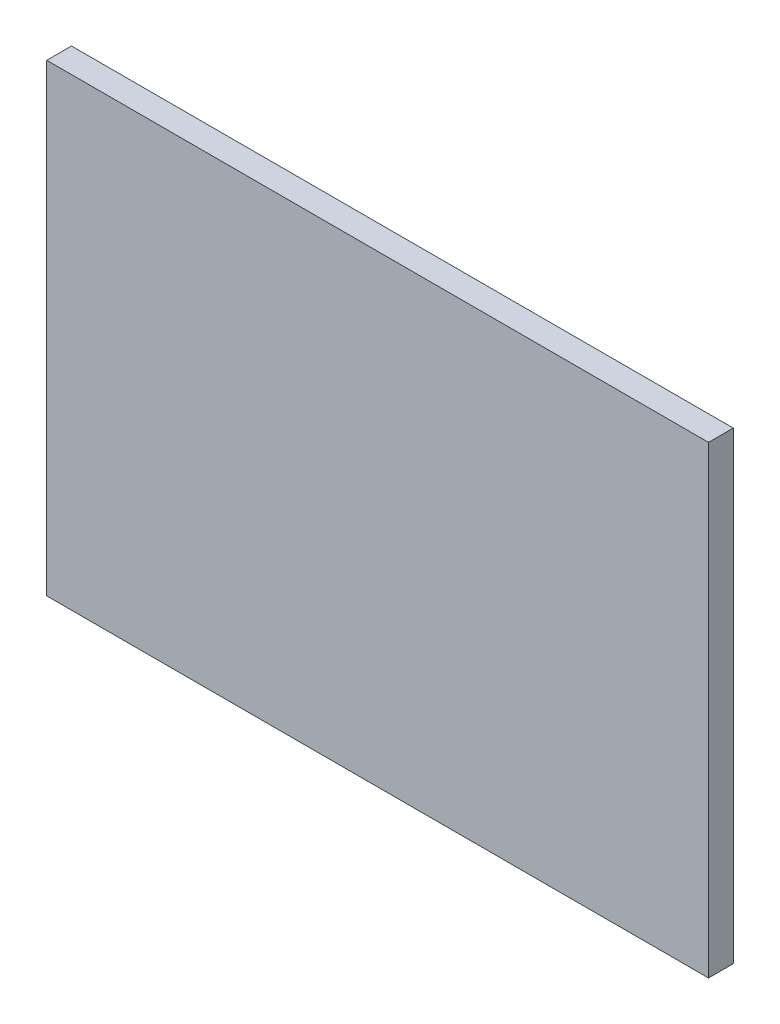
from build123d import *

# Parameters (mm, degrees)
SKETCH_1_W      = 3210
SKETCH_1_H      = 2250
EXTRUDE_1_DEPTH = 60


with BuildPart() as part:
    # Эскиз1 → Бобышка-Вытянуть1 (new, symmetric)
    with BuildSketch(Plane.XY):
        Rectangle(SKETCH_1_W, SKETCH_1_H)
    extrude(amount=EXTRUDE_1_DEPTH, both=True)


solid = part.part
